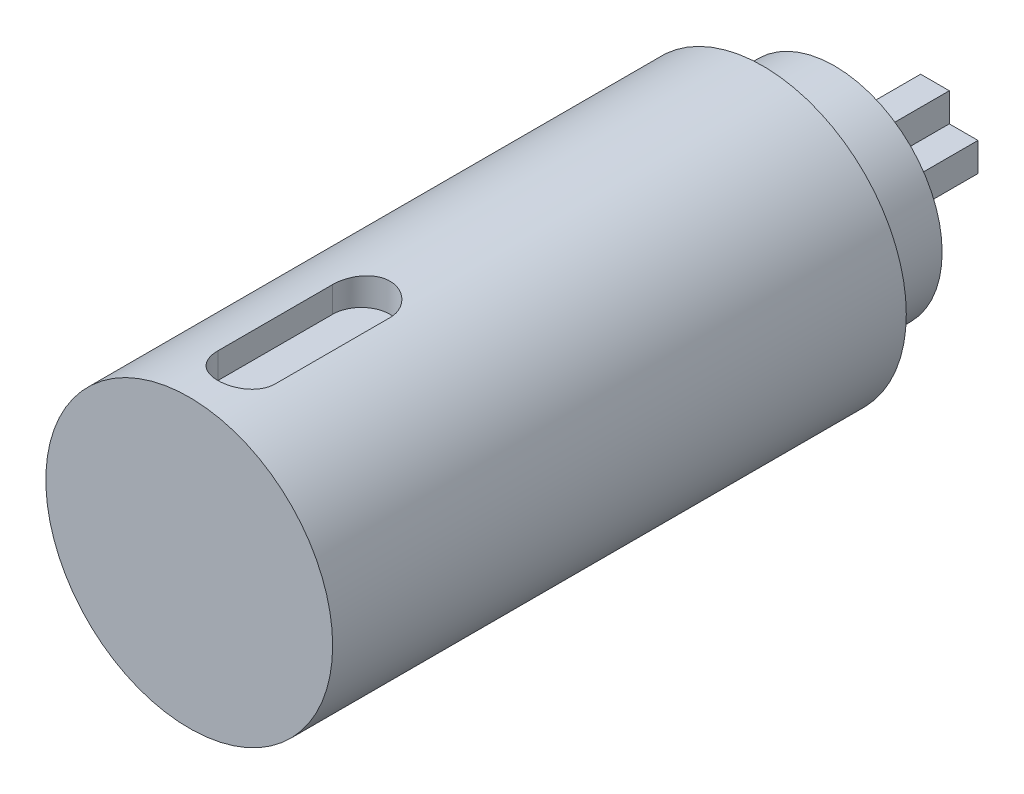
from build123d import *

# Parameters (mm, degrees)
SKETCH_1_R          = 7.5
EXTRUDE_1_DEPTH     = 5
SKETCH_2_W          = 2
SKETCH_2_H          = 2
EXTRUDE_2_DEPTH     = 7
SKETCH_3_R          = 10
EXTRUDE_3_DEPTH     = 40
CUT_EXTRUDE_1_DEPTH = 2


with BuildPart() as part:
    # 草图1 → 凸台-拉伸1 (new body)
    with BuildSketch(Plane.XY):
        Circle(SKETCH_1_R)
    extrude(amount=EXTRUDE_1_DEPTH)

    # 草图2 → 凸台-拉伸2 (add)
    with BuildSketch(Plane(origin=(0, 0, 0), x_dir=(-1, 0, 0), z_dir=(0, 0, -1))):
        with Locations((-2, 0)):
            Rectangle(SKETCH_2_W, SKETCH_2_H)
        with Locations((0, 2)):
            Rectangle(SKETCH_2_W, SKETCH_2_H)
        with Locations((2, 0)):
            Rectangle(SKETCH_2_W, SKETCH_2_H)
        Rectangle(SKETCH_2_W, SKETCH_2_H)
        with Locations((0, -2)):
            Rectangle(SKETCH_2_W, SKETCH_2_H)
    extrude(amount=EXTRUDE_2_DEPTH)

    # 草图3 → 凸台-拉伸3 (add)
    with BuildSketch(Plane.XY.offset(5)):
        Circle(SKETCH_3_R)
    extrude(amount=EXTRUDE_3_DEPTH)

    # 草图4 → 切除-拉伸1 (cut)
    with BuildSketch(Plane(origin=(0, 10, 0), x_dir=(1, 0, 0), z_dir=(0, 1, 0))):
        with BuildLine():
            Line((-2, -41), (-2, -33))
            ThreePointArc((-2, -33), (0, -31), (2, -33))
            Line((2, -33), (2, -41))
            ThreePointArc((2, -41), (0, -43), (-2, -41))
        make_face()
    extrude(amount=-CUT_EXTRUDE_1_DEPTH, mode=Mode.SUBTRACT)


solid = part.part
